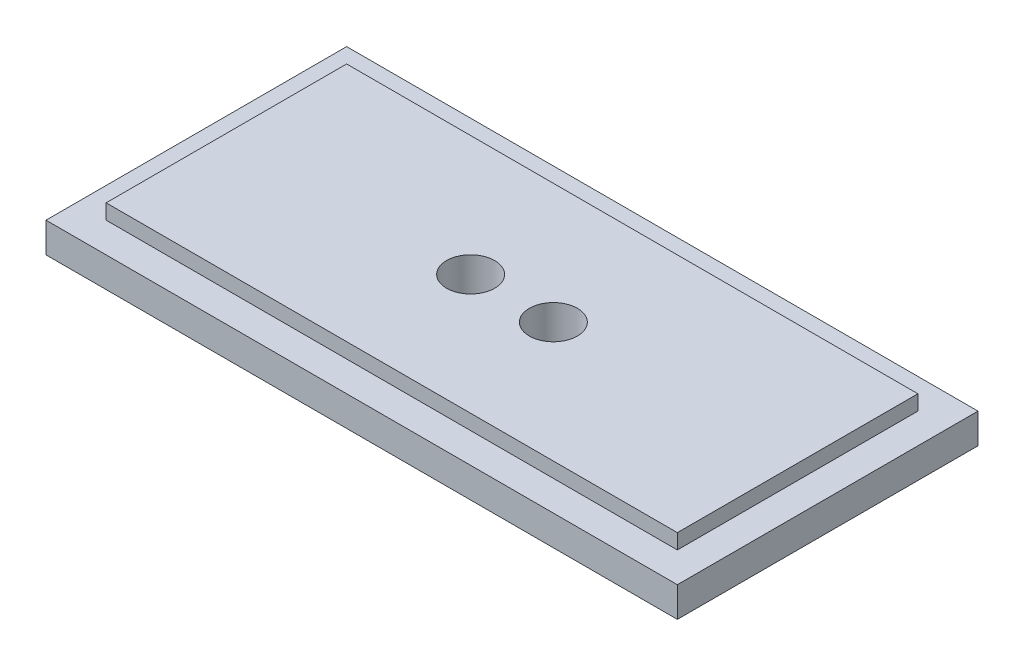
from build123d import *

# Parameters (mm, degrees)
SKETCH1_W               = 210
SKETCH1_H               = 100
BOSS_EXTRUDE1_DEPTH     = 10
SKETCH2_W               = 190
SKETCH2_H               = 80
BOSS_EXTRUDE2_DEPTH     = 5
SKETCH3_W               = 57
SKETCH3_H               = 32
SKETCH3_W_2             = 47
SKETCH3_H_2             = 22
BOSS_EXTRUDE3_DEPTH     = 15
CUT_EXTRUDE1_DEPTH      = 118.260393996
CUT_EXTRUDE1_DEPTH_BACK = 118.260393996
SKETCH4_R               = 8


with BuildPart() as part:
    # Sketch1 → Boss-Extrude1 (new body)
    with BuildSketch(Plane(origin=(0, 0, 0), x_dir=(1, 0, 0), z_dir=(0, 1, 0))):
        Rectangle(SKETCH1_W, SKETCH1_H)
    extrude(amount=BOSS_EXTRUDE1_DEPTH)

    # Sketch2 → Boss-Extrude2 (add)
    with BuildSketch(Plane(origin=(0, 10, 0), x_dir=(1, 0, 0), z_dir=(0, 1, 0))):
        Rectangle(SKETCH2_W, SKETCH2_H)
    extrude(amount=BOSS_EXTRUDE2_DEPTH)

    # Sketch3 → Boss-Extrude3 (add)
    with BuildSketch(Plane.XZ):
        Rectangle(SKETCH3_W, SKETCH3_H)
        Rectangle(SKETCH3_W_2, SKETCH3_H_2, mode=Mode.SUBTRACT)
    extrude(amount=BOSS_EXTRUDE3_DEPTH)

    # Sketch4 → Cut-Extrude1 (cut, two sides: drawn at the far end of the back side and taken through both)
    with BuildSketch(Plane.XZ.offset(-CUT_EXTRUDE1_DEPTH_BACK)):
        with Locations(Location((-13.76, 0, 0), (0, 0, 270))):
            Circle(SKETCH4_R)
        with Locations(Location((13.76, 0, 0), (0, 0, 90))):
            Circle(SKETCH4_R)
    extrude(amount=CUT_EXTRUDE1_DEPTH + CUT_EXTRUDE1_DEPTH_BACK, mode=Mode.SUBTRACT)


solid = part.part
